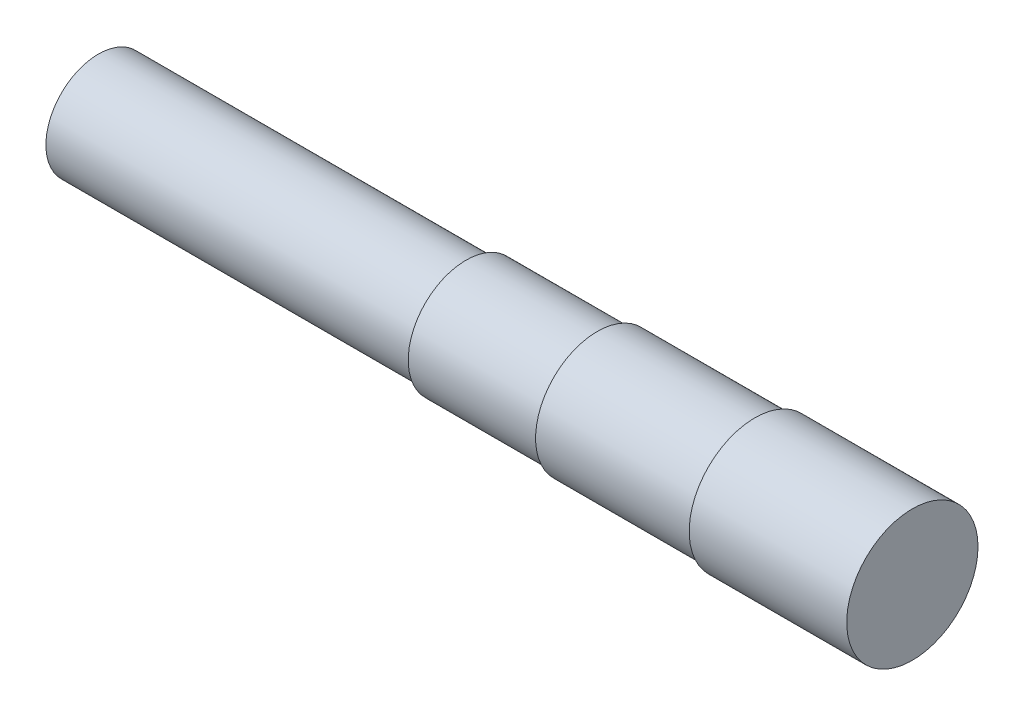
from build123d import *

# Parameters (mm, degrees)
SKETCH1_W = 30
SKETCH1_H = 0.75


with BuildPart() as part:
    # Sketch1 → Revolve1 (revolve)
    with BuildSketch(Plane.XY, mode=Mode.PRIVATE) as revolve1_sk:
        Polygon((-55, 10), (-125, 10), (-125, 0), (-32.608695652, 0), (0, 0), (30, 0), (30, 12.5), (0, 12.5), (0, 11), (-55, 11), align=None)
        with Locations((-15, 11.375)):
            Rectangle(SKETCH1_W, SKETCH1_H)
    revolve(revolve1_sk.sketch.rotate(Axis((0, 0, 0), (-1, 0, 0)), 90), axis=Axis((0, 0, 0), (-1, 0, 0)))


solid = part.part
